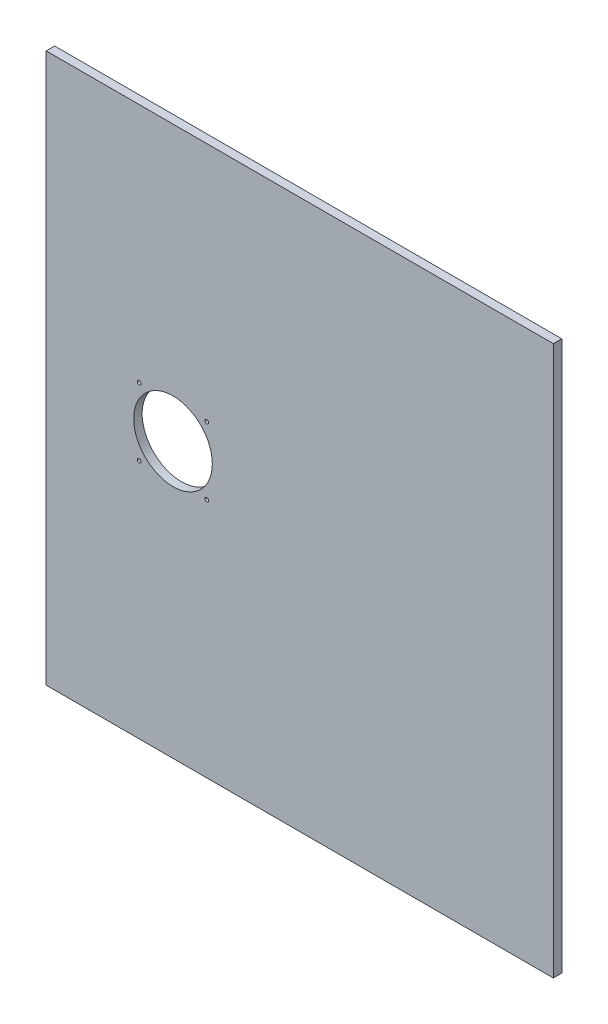
from build123d import *

# Parameters (mm, degrees)
ESQUISSE1_W             = 600
ESQUISSE1_H             = 650
BOSS_EXTRU_1_DEPTH      = 10
ESQUISSE2_R             = 46.5
ESQUISSE2_R_2           = 2.25
ENL_V_MAT_EXTRU_1_DEPTH = 10


with BuildPart() as part:
    # Esquisse1 → Boss.-Extru.1 (new body)
    with BuildSketch(Plane.XY):
        with Locations((300, -325)):
            Rectangle(ESQUISSE1_W, ESQUISSE1_H)
    extrude(amount=BOSS_EXTRU_1_DEPTH)

    # Esquisse2 → Enlèv. mat.-Extru.1 (cut)
    with BuildSketch(Plane.XY.offset(10)):
        with Locations((150, -325)):
            Circle(ESQUISSE2_R)
        with Locations((110, -285)):
            Circle(ESQUISSE2_R_2)
        with Locations((190, -285)):
            Circle(ESQUISSE2_R_2)
        with Locations((190, -365)):
            Circle(ESQUISSE2_R_2)
        with Locations((110, -365)):
            Circle(ESQUISSE2_R_2)
    extrude(amount=-ENL_V_MAT_EXTRU_1_DEPTH, mode=Mode.SUBTRACT)


solid = part.part
